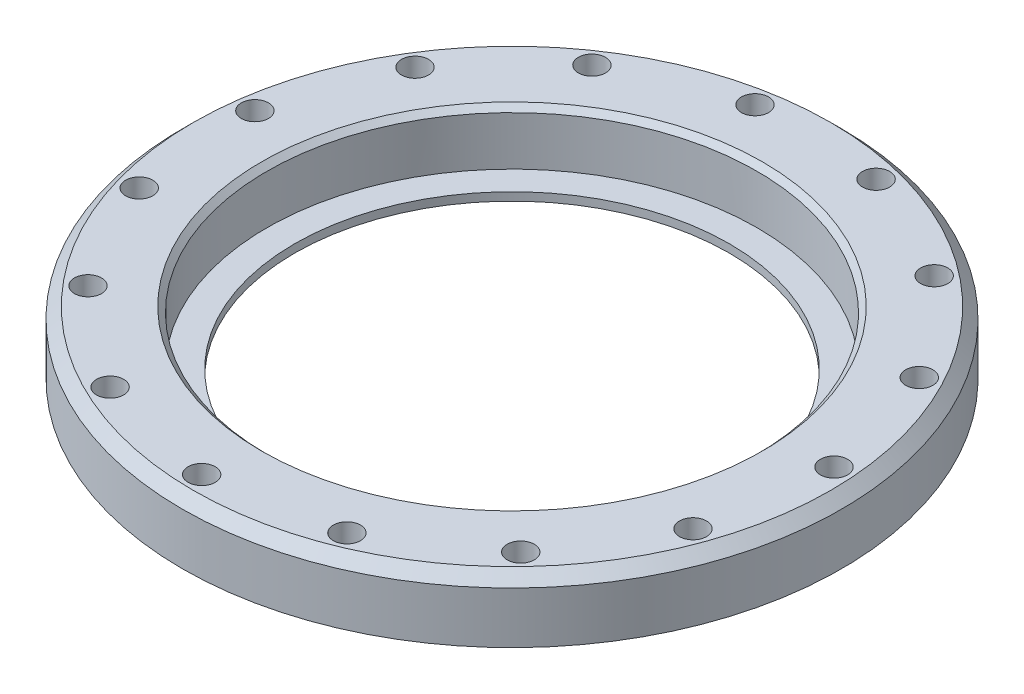
from build123d import *

# Parameters (mm, degrees)
SKETCH1_R           = 60.65
BOSS_EXTRUDE1_DEPTH = 11
BOSS_EXTRUDE2_START = -11.5
SKETCH2_R           = 60.65
SKETCH2_R_2         = 45.1
BOSS_EXTRUDE2_DEPTH = 11.5
SKETCH3_R           = 45.1
SKETCH3_R_2         = 40
BOSS_EXTRUDE3_DEPTH = 1.5
CHAMFER1_SIZE       = 1
SKETCH5_R           = 2.5
CUT_EXTRUDE2_DEPTH  = 87.539557429
SKETCH6_R           = 2.15
CUT_EXTRUDE3_DEPTH  = 10
CHAMFER3_SIZE       = 0.5
CIRPATTERN6_COUNT   = 15
CHAMFER4_SIZE       = 2


with BuildPart() as part:
    # Sketch1 → Boss-Extrude1 (new body)
    with BuildSketch(Plane(origin=(0, 0, 0), x_dir=(1, 0, 0), z_dir=(0, 1, 0))):
        with Locations(Location((0, 0, 0), (0, 0, 270))):
            Circle(SKETCH1_R)
        with BuildLine():
            ThreePointArc((-50.081229659, 1.371289853), (-50.1, 0), (-50.081229659, -1.371289853))
            ThreePointArc((-50.081229659, -1.371289853), (-52.028426313, -3.558841857), (-49.801494327, -5.46087564))
            ThreePointArc((-49.801494327, -5.46087564), (-49.633365896, -6.82194912), (-49.428046439, -8.17791081))
            ThreePointArc((-49.428046439, -8.17791081), (-51.059235173, -10.610231081), (-48.594051385, -12.191315352))
            ThreePointArc((-48.594051385, -12.191315352), (-48.242156096, -13.516818235), (-47.854112236, -14.832192763))
            ThreePointArc((-47.854112236, -14.832192763), (-49.138907088, -17.463971775), (-46.481393208, -18.694653926))
            ThreePointArc((-46.481393208, -18.694653926), (-45.952286205, -19.959894601), (-45.388746465, -21.210179027))
            ThreePointArc((-45.388746465, -21.210179027), (-46.30321414, -23.992391718), (-43.502874622, -24.849746469))
            ThreePointArc((-43.502874622, -24.849746469), (-42.806412168, -26.031155897), (-42.077874226, -27.193059788))
            ThreePointArc((-42.077874226, -27.193059788), (-42.60497992, -30.073878798), (-39.713979793, -30.541935253))
            ThreePointArc((-39.713979793, -30.541935253), (-38.863135664, -31.617506011), (-37.983170805, -32.669385296))
            ThreePointArc((-37.983170805, -32.669385296), (-38.113095537, -35.595146419), (-35.185288662, -35.665185571))
            ThreePointArc((-35.185288662, -35.665185571), (-34.195912475, -36.61488181), (-33.180912778, -37.537141969))
            ThreePointArc((-33.180912778, -37.537141969), (-32.911236297, -40.45334381), (-30.001162176, -40.124060962))
            ThreePointArc((-30.001162176, -40.124060962), (-28.891684138, -40.93019164), (-27.760557127, -41.70565271))
            ThreePointArc((-27.760557127, -41.70565271), (-27.096302994, -44.557971947), (-24.258170803, -43.835501016))
            ThreePointArc((-24.258170803, -43.835501016), (-23.04925839, -44.483049442), (-21.823074822, -45.097266051))
            ThreePointArc((-21.823074822, -45.097266051), (-20.776616835, -47.832569374), (-18.063295606, -46.730368625))
            ThreePointArc((-18.063295606, -46.730368625), (-16.77746857, -47.207272198), (-15.479069924, -47.648802653))
            ThreePointArc((-15.479069924, -47.648802653), (-14.069901616, -50.216136535), (-11.531935389, -48.754737884))
            ThreePointArc((-11.531935389, -48.754737884), (-10.193146254, -49.052112793), (-8.846719241, -49.312732217))
            ThreePointArc((-8.846719241, -49.312732217), (-7.10109075, -51.664272086), (-4.785757036, -49.870898624))
            ThreePointArc((-4.785757036, -49.870898624), (-3.41894491, -49.983205336), (-2.049570917, -50.058058882))
            ThreePointArc((-2.049570917, -50.058058882), (0, -52.15), (2.049570917, -50.058058882))
            ThreePointArc((2.049570917, -50.058058882), (3.41894491, -49.983205336), (4.785757036, -49.870898624))
            ThreePointArc((4.785757036, -49.870898624), (7.10109075, -51.664272086), (8.846719241, -49.312732217))
            ThreePointArc((8.846719241, -49.312732217), (10.193146254, -49.052112793), (11.531935389, -48.754737884))
            ThreePointArc((11.531935389, -48.754737884), (14.069901616, -50.216136535), (15.479069924, -47.648802653))
            ThreePointArc((15.479069924, -47.648802653), (16.77746857, -47.207272198), (18.063295606, -46.730368625))
            ThreePointArc((18.063295606, -46.730368625), (20.776616835, -47.832569374), (21.823074822, -45.097266051))
            ThreePointArc((21.823074822, -45.097266051), (23.04925839, -44.483049442), (24.258170803, -43.835501016))
            ThreePointArc((24.258170803, -43.835501016), (27.096302994, -44.557971947), (27.760557127, -41.70565271))
            ThreePointArc((27.760557127, -41.70565271), (28.891684138, -40.93019164), (30.001162176, -40.124060962))
            ThreePointArc((30.001162176, -40.124060962), (32.911236297, -40.45334381), (33.180912778, -37.537141969))
            ThreePointArc((33.180912778, -37.537141969), (34.195912475, -36.61488181), (35.185288662, -35.665185571))
            ThreePointArc((35.185288662, -35.665185571), (38.113095537, -35.595146419), (37.983170805, -32.669385296))
            ThreePointArc((37.983170805, -32.669385296), (38.863135664, -31.617506011), (39.713979793, -30.541935253))
            ThreePointArc((39.713979793, -30.541935253), (42.60497992, -30.073878798), (42.077874226, -27.193059788))
            ThreePointArc((42.077874226, -27.193059788), (42.806412168, -26.031155897), (43.502874622, -24.849746469))
            ThreePointArc((43.502874622, -24.849746469), (46.30321414, -23.992391718), (45.388746465, -21.210179027))
            ThreePointArc((45.388746465, -21.210179027), (45.952286205, -19.959894601), (46.481393208, -18.694653926))
            ThreePointArc((46.481393208, -18.694653926), (49.138907088, -17.463971775), (47.854112236, -14.832192763))
            ThreePointArc((47.854112236, -14.832192763), (48.242156096, -13.516818235), (48.594051385, -12.191315352))
            ThreePointArc((48.594051385, -12.191315352), (51.059235173, -10.610231081), (49.428046439, -8.17791081))
            ThreePointArc((49.428046439, -8.17791081), (49.633365896, -6.82194912), (49.801494327, -5.46087564))
            ThreePointArc((49.801494327, -5.46087564), (52.028426313, -3.558841857), (50.081229659, -1.371289853))
            ThreePointArc((50.081229659, -1.371289853), (50.1, 0), (50.081229659, 1.371289853))
            ThreePointArc((50.081229659, 1.371289853), (52.028426313, 3.558841857), (49.801494327, 5.46087564))
            ThreePointArc((49.801494327, 5.46087564), (49.633365896, 6.82194912), (49.428046439, 8.17791081))
            ThreePointArc((49.428046439, 8.17791081), (51.059235173, 10.610231081), (48.594051385, 12.191315352))
            ThreePointArc((48.594051385, 12.191315352), (48.242156096, 13.516818235), (47.854112236, 14.832192763))
            ThreePointArc((47.854112236, 14.832192763), (49.138907088, 17.463971775), (46.481393208, 18.694653926))
            ThreePointArc((46.481393208, 18.694653926), (45.952286205, 19.959894601), (45.388746465, 21.210179027))
            ThreePointArc((45.388746465, 21.210179027), (46.30321414, 23.992391718), (43.502874622, 24.849746469))
            ThreePointArc((43.502874622, 24.849746469), (42.806412168, 26.031155897), (42.077874226, 27.193059788))
            ThreePointArc((42.077874226, 27.193059788), (42.60497992, 30.073878798), (39.713979793, 30.541935253))
            ThreePointArc((39.713979793, 30.541935253), (38.863135664, 31.617506011), (37.983170805, 32.669385296))
            ThreePointArc((37.983170805, 32.669385296), (38.113095537, 35.595146419), (35.185288662, 35.665185571))
            ThreePointArc((35.185288662, 35.665185571), (34.195912475, 36.61488181), (33.180912778, 37.537141969))
            ThreePointArc((33.180912778, 37.537141969), (32.911236297, 40.45334381), (30.001162176, 40.124060962))
            ThreePointArc((30.001162176, 40.124060962), (28.891684138, 40.93019164), (27.760557127, 41.70565271))
            ThreePointArc((27.760557127, 41.70565271), (27.096302994, 44.557971947), (24.258170803, 43.835501016))
            ThreePointArc((24.258170803, 43.835501016), (23.04925839, 44.483049442), (21.823074822, 45.097266051))
            ThreePointArc((21.823074822, 45.097266051), (20.776616835, 47.832569374), (18.063295606, 46.730368625))
            ThreePointArc((18.063295606, 46.730368625), (16.77746857, 47.207272198), (15.479069924, 47.648802653))
            ThreePointArc((15.479069924, 47.648802653), (14.069901616, 50.216136535), (11.531935389, 48.754737884))
            ThreePointArc((11.531935389, 48.754737884), (10.193146254, 49.052112793), (8.846719241, 49.312732217))
            ThreePointArc((8.846719241, 49.312732217), (7.10109075, 51.664272086), (4.785757036, 49.870898624))
            ThreePointArc((4.785757036, 49.870898624), (3.41894491, 49.983205336), (2.049570917, 50.058058882))
            ThreePointArc((2.049570917, 50.058058882), (0, 52.15), (-2.049570917, 50.058058882))
            ThreePointArc((-2.049570917, 50.058058882), (-3.41894491, 49.983205336), (-4.785757036, 49.870898624))
            ThreePointArc((-4.785757036, 49.870898624), (-7.10109075, 51.664272086), (-8.846719241, 49.312732217))
            ThreePointArc((-8.846719241, 49.312732217), (-10.193146254, 49.052112793), (-11.531935389, 48.754737884))
            ThreePointArc((-11.531935389, 48.754737884), (-14.069901616, 50.216136535), (-15.479069924, 47.648802653))
            ThreePointArc((-15.479069924, 47.648802653), (-16.77746857, 47.207272198), (-18.063295606, 46.730368625))
            ThreePointArc((-18.063295606, 46.730368625), (-20.776616835, 47.832569374), (-21.823074822, 45.097266051))
            ThreePointArc((-21.823074822, 45.097266051), (-23.04925839, 44.483049442), (-24.258170803, 43.835501016))
            ThreePointArc((-24.258170803, 43.835501016), (-27.096302994, 44.557971947), (-27.760557127, 41.70565271))
            ThreePointArc((-27.760557127, 41.70565271), (-28.891684138, 40.93019164), (-30.001162176, 40.124060962))
            ThreePointArc((-30.001162176, 40.124060962), (-32.911236297, 40.45334381), (-33.180912778, 37.537141969))
            ThreePointArc((-33.180912778, 37.537141969), (-34.195912475, 36.61488181), (-35.185288662, 35.665185571))
            ThreePointArc((-35.185288662, 35.665185571), (-38.113095537, 35.595146419), (-37.983170805, 32.669385296))
            ThreePointArc((-37.983170805, 32.669385296), (-38.863135664, 31.617506011), (-39.713979793, 30.541935253))
            ThreePointArc((-39.713979793, 30.541935253), (-42.60497992, 30.073878798), (-42.077874226, 27.193059788))
            ThreePointArc((-42.077874226, 27.193059788), (-42.806412168, 26.031155897), (-43.502874622, 24.849746469))
            ThreePointArc((-43.502874622, 24.849746469), (-46.30321414, 23.992391718), (-45.388746465, 21.210179027))
            ThreePointArc((-45.388746465, 21.210179027), (-45.952286205, 19.959894601), (-46.481393208, 18.694653926))
            ThreePointArc((-46.481393208, 18.694653926), (-49.138907088, 17.463971775), (-47.854112236, 14.832192763))
            ThreePointArc((-47.854112236, 14.832192763), (-48.242156096, 13.516818235), (-48.594051385, 12.191315352))
            ThreePointArc((-48.594051385, 12.191315352), (-51.059235173, 10.610231081), (-49.428046439, 8.17791081))
            ThreePointArc((-49.428046439, 8.17791081), (-49.633365896, 6.82194912), (-49.801494327, 5.46087564))
            ThreePointArc((-49.801494327, 5.46087564), (-52.028426313, 3.558841857), (-50.081229659, 1.371289853))
        make_face(mode=Mode.SUBTRACT)
    extrude(amount=BOSS_EXTRUDE1_DEPTH)

    # Sketch2 → Boss-Extrude2 (add)
    with BuildSketch(Plane(origin=(0, 11, 0), x_dir=(1, 0, 0), z_dir=(0, 1, 0)).offset(BOSS_EXTRUDE2_START)):
        with Locations(Location((0, 0, 0), (0, 0, 270))):
            Circle(SKETCH2_R)
        with Locations(Location((0, 0, 0), (0, 0, 270))):
            Circle(SKETCH2_R_2, mode=Mode.SUBTRACT)
    extrude(amount=BOSS_EXTRUDE2_DEPTH)

    # Sketch3 → Boss-Extrude3 (add)
    with BuildSketch(Plane.XZ.offset(0.5)):
        with Locations(Location((0, 0, 0), (0, 0, 90))):
            Circle(SKETCH3_R)
        with Locations(Location((0, 0, 0), (0, 0, 270))):
            Circle(SKETCH3_R_2, mode=Mode.SUBTRACT)
    extrude(amount=-BOSS_EXTRUDE3_DEPTH)

    # Chamfer1
    chamfer1_edges = [part.edges().sort_by_distance(p)[0] for p in [
        (0, 11, -45.1),
    ]]
    chamfer(chamfer1_edges, length=CHAMFER1_SIZE)

    # Sketch5 → Cut-Extrude2 (cut, symmetric)
    with BuildSketch(Plane.XZ.offset(0.5)):
        with Locations(Location((13.233273488, -53.770541171, 0), (0, 0, 270))):
            Circle(SKETCH5_R)
    cut_extrude2 = extrude(amount=CUT_EXTRUDE2_DEPTH, both=True, mode=Mode.SUBTRACT)

    # Sketch6 → Cut-Extrude3 (cut)
    with BuildSketch(Plane.XZ.offset(0.5)):
        with Locations(Location((0, -50.1, 0), (0, 0, 270))):
            Circle(SKETCH6_R)
        with Locations(Location((-6.82194912, -49.633365896, 0), (0, 0, 270))):
            Circle(SKETCH6_R)
        with Locations(Location((-13.516818235, -48.242156096, 0), (0, 0, 270))):
            Circle(SKETCH6_R)
        with Locations(Location((-19.959894601, -45.952286205, 0), (0, 0, 270))):
            Circle(SKETCH6_R)
        with Locations(Location((-26.031155897, -42.806412168, 0), (0, 0, 270))):
            Circle(SKETCH6_R)
        with Locations(Location((-31.617506011, -38.863135664, 0), (0, 0, 270))):
            Circle(SKETCH6_R)
        with Locations(Location((-36.61488181, -34.195912475, 0), (0, 0, 270))):
            Circle(SKETCH6_R)
        with Locations(Location((-40.93019164, -28.891684138, 0), (0, 0, 270))):
            Circle(SKETCH6_R)
        with Locations(Location((-44.483049442, -23.04925839, 0), (0, 0, 270))):
            Circle(SKETCH6_R)
        with Locations(Location((-47.207272198, -16.77746857, 0), (0, 0, 270))):
            Circle(SKETCH6_R)
        with Locations(Location((-49.052112793, -10.193146254, 0), (0, 0, 270))):
            Circle(SKETCH6_R)
        with Locations(Location((-49.983205336, -3.41894491, 0), (0, 0, 270))):
            Circle(SKETCH6_R)
        with Locations(Location((-49.983205336, 3.41894491, 0), (0, 0, 270))):
            Circle(SKETCH6_R)
        with Locations(Location((-49.052112793, 10.193146254, 0), (0, 0, 270))):
            Circle(SKETCH6_R)
        with Locations(Location((-47.207272198, 16.77746857, 0), (0, 0, 270))):
            Circle(SKETCH6_R)
        with Locations(Location((-44.483049442, 23.04925839, 0), (0, 0, 270))):
            Circle(SKETCH6_R)
        with Locations(Location((-40.93019164, 28.891684138, 0), (0, 0, 270))):
            Circle(SKETCH6_R)
        with Locations(Location((-36.61488181, 34.195912475, 0), (0, 0, 270))):
            Circle(SKETCH6_R)
        with Locations(Location((-31.617506011, 38.863135664, 0), (0, 0, 270))):
            Circle(SKETCH6_R)
        with Locations(Location((-26.031155897, 42.806412168, 0), (0, 0, 270))):
            Circle(SKETCH6_R)
        with Locations(Location((-19.959894601, 45.952286205, 0), (0, 0, 270))):
            Circle(SKETCH6_R)
        with Locations(Location((-13.516818235, 48.242156096, 0), (0, 0, 270))):
            Circle(SKETCH6_R)
        with Locations(Location((-6.82194912, 49.633365896, 0), (0, 0, 270))):
            Circle(SKETCH6_R)
        with Locations(Location((0, 50.1, 0), (0, 0, 270))):
            Circle(SKETCH6_R)
        with Locations(Location((6.82194912, 49.633365896, 0), (0, 0, 270))):
            Circle(SKETCH6_R)
        with Locations(Location((13.516818235, 48.242156096, 0), (0, 0, 270))):
            Circle(SKETCH6_R)
        with Locations(Location((19.959894601, 45.952286205, 0), (0, 0, 270))):
            Circle(SKETCH6_R)
        with Locations(Location((26.031155897, 42.806412168, 0), (0, 0, 270))):
            Circle(SKETCH6_R)
        with Locations(Location((31.617506011, 38.863135664, 0), (0, 0, 270))):
            Circle(SKETCH6_R)
        with Locations(Location((36.61488181, 34.195912475, 0), (0, 0, 270))):
            Circle(SKETCH6_R)
        with Locations(Location((40.93019164, 28.891684138, 0), (0, 0, 270))):
            Circle(SKETCH6_R)
        with Locations(Location((44.483049442, 23.04925839, 0), (0, 0, 270))):
            Circle(SKETCH6_R)
        with Locations(Location((47.207272198, 16.77746857, 0), (0, 0, 270))):
            Circle(SKETCH6_R)
        with Locations(Location((49.052112793, 10.193146254, 0), (0, 0, 270))):
            Circle(SKETCH6_R)
        with Locations(Location((49.983205336, 3.41894491, 0), (0, 0, 270))):
            Circle(SKETCH6_R)
        with Locations(Location((49.983205336, -3.41894491, 0), (0, 0, 270))):
            Circle(SKETCH6_R)
        with Locations(Location((49.052112793, -10.193146254, 0), (0, 0, 270))):
            Circle(SKETCH6_R)
        with Locations(Location((47.207272198, -16.77746857, 0), (0, 0, 270))):
            Circle(SKETCH6_R)
        with Locations(Location((44.483049442, -23.04925839, 0), (0, 0, 270))):
            Circle(SKETCH6_R)
        with Locations(Location((40.93019164, -28.891684138, 0), (0, 0, 270))):
            Circle(SKETCH6_R)
        with Locations(Location((36.61488181, -34.195912475, 0), (0, 0, 270))):
            Circle(SKETCH6_R)
        with Locations(Location((31.617506011, -38.863135664, 0), (0, 0, 270))):
            Circle(SKETCH6_R)
        with Locations(Location((26.031155897, -42.806412168, 0), (0, 0, 270))):
            Circle(SKETCH6_R)
        with Locations(Location((19.959894601, -45.952286205, 0), (0, 0, 270))):
            Circle(SKETCH6_R)
        with Locations(Location((13.516818235, -48.242156096, 0), (0, 0, 270))):
            Circle(SKETCH6_R)
        with Locations(Location((6.82194912, -49.633365896, 0), (0, 0, 270))):
            Circle(SKETCH6_R)
    extrude(amount=-CUT_EXTRUDE3_DEPTH, mode=Mode.SUBTRACT)

    # Chamfer3
    chamfer3_edges = [part.edges().sort_by_distance(p)[0] for p in [
        (47.207272198, -0.5, 18.92746857),
        (44.483049442, -0.5, 25.19925839),
        (40.93019164, -0.5, 31.041684138),
        (36.61488181, -0.5, 36.345912475),
        (31.617506011, -0.5, 41.013135664),
        (26.031155897, -0.5, 44.956412168),
        (19.959894601, -0.5, 48.102286205),
        (13.516818235, -0.5, 50.392156096),
        (6.82194912, -0.5, 51.783365896),
        (0, -0.5, 52.25),
        (-6.82194912, -0.5, 51.783365896),
        (-13.516818235, -0.5, 50.392156096),
        (-19.959894601, -0.5, 48.102286205),
        (-26.031155897, -0.5, 44.956412168),
        (-31.617506011, -0.5, 41.013135664),
        (-36.61488181, -0.5, 36.345912475),
        (-40.93019164, -0.5, 31.041684138),
        (-44.483049442, -0.5, 25.19925839),
        (-47.207272198, -0.5, 18.92746857),
        (-49.052112793, -0.5, 12.343146254),
        (-49.983205336, -0.5, 5.56894491),
        (-49.983205336, -0.5, -1.26894491),
        (-49.052112793, -0.5, -8.043146254),
        (-47.207272198, -0.5, -14.62746857),
        (-44.483049442, -0.5, -20.89925839),
        (-40.93019164, -0.5, -26.741684138),
        (-36.61488181, -0.5, -32.045912475),
        (-31.617506011, -0.5, -36.713135664),
        (-26.031155897, -0.5, -40.656412168),
        (-19.959894601, -0.5, -43.802286205),
        (-13.516818235, -0.5, -46.092156096),
        (-6.82194912, -0.5, -47.483365896),
        (49.052112793, -0.5, 12.343146254),
        (49.983205336, -0.5, 5.56894491),
        (49.983205336, -0.5, -1.26894491),
        (49.052112793, -0.5, -8.043146254),
        (47.207272198, -0.5, -14.62746857),
        (44.483049442, -0.5, -20.89925839),
        (40.93019164, -0.5, -26.741684138),
        (36.61488181, -0.5, -32.045912475),
        (31.617506011, -0.5, -36.713135664),
        (26.031155897, -0.5, -40.656412168),
        (19.959894601, -0.5, -43.802286205),
        (13.516818235, -0.5, -46.092156096),
        (6.82194912, -0.5, -47.483365896),
        (0, -0.5, -47.95),
    ]]
    chamfer(chamfer3_edges, length=CHAMFER3_SIZE)

    # CirPattern6: Cut-Extrude2 ×15 about axis
    cirpattern6_axis = Axis((0, 0, 0), (0, 1, 0))
    for i in range(1, CIRPATTERN6_COUNT):
        add(cut_extrude2.rotate(cirpattern6_axis, i * 360 / CIRPATTERN6_COUNT), mode=Mode.SUBTRACT)

    # Chamfer4
    chamfer4_edges = [part.edges().sort_by_distance(p)[0] for p in [
        (0, 11, -60.65),
    ]]
    chamfer(chamfer4_edges, length=CHAMFER4_SIZE)


solid = part.part
